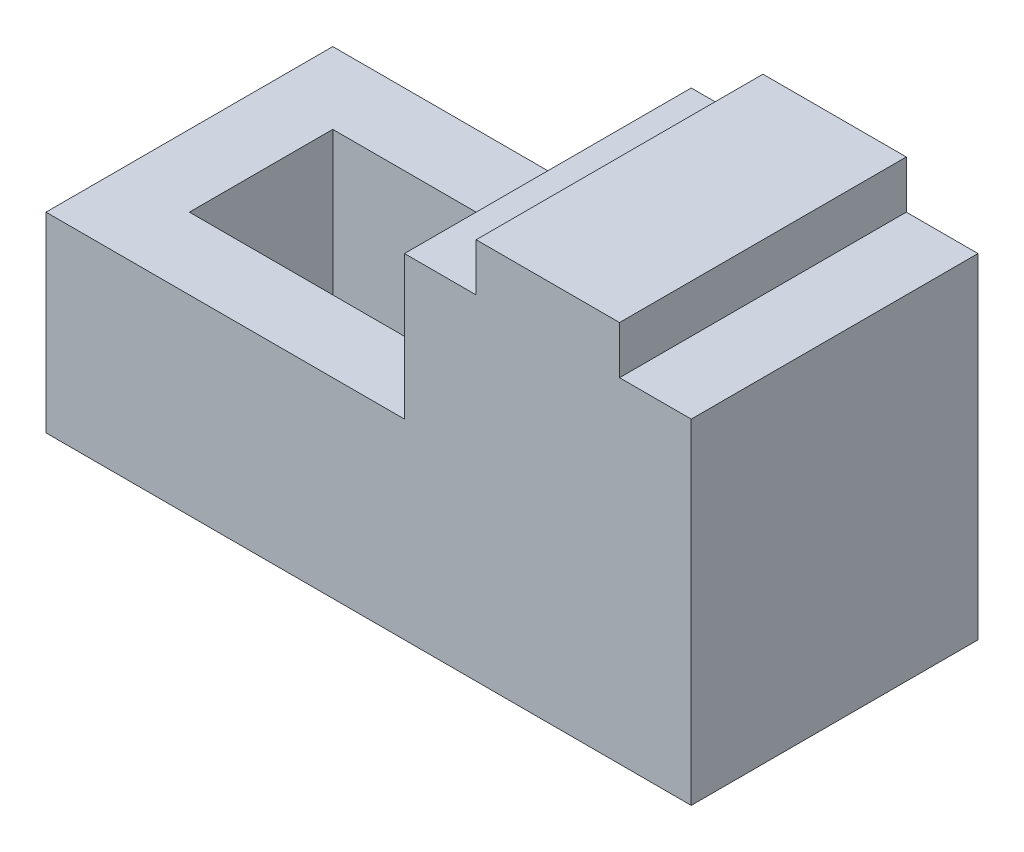
from build123d import *

# Parameters (mm, degrees)
BOSS_EXTRUDE1_DEPTH = 48
SKETCH4_W           = 48
SKETCH4_H           = 24
CUT_EXTRUDE1_DEPTH  = 24


with BuildPart() as part:
    # Sketch1 → Boss-Extrude1 (new body)
    with BuildSketch(Plane.XY):
        Polygon((0, 0), (108, 0), (108, 56), (96, 56), (96, 64), (72, 64), (72, 56), (60, 56), (60, 32), (0, 32), align=None)
    extrude(amount=BOSS_EXTRUDE1_DEPTH)

    # Sketch4 → Cut-Extrude1 (cut)
    with BuildSketch(Plane(origin=(0, 32, 0), x_dir=(1, 0, 0), z_dir=(0, 1, 0))):
        with Locations((36, -24)):
            Rectangle(SKETCH4_W, SKETCH4_H)
    extrude(amount=-CUT_EXTRUDE1_DEPTH, mode=Mode.SUBTRACT)


solid = part.part
